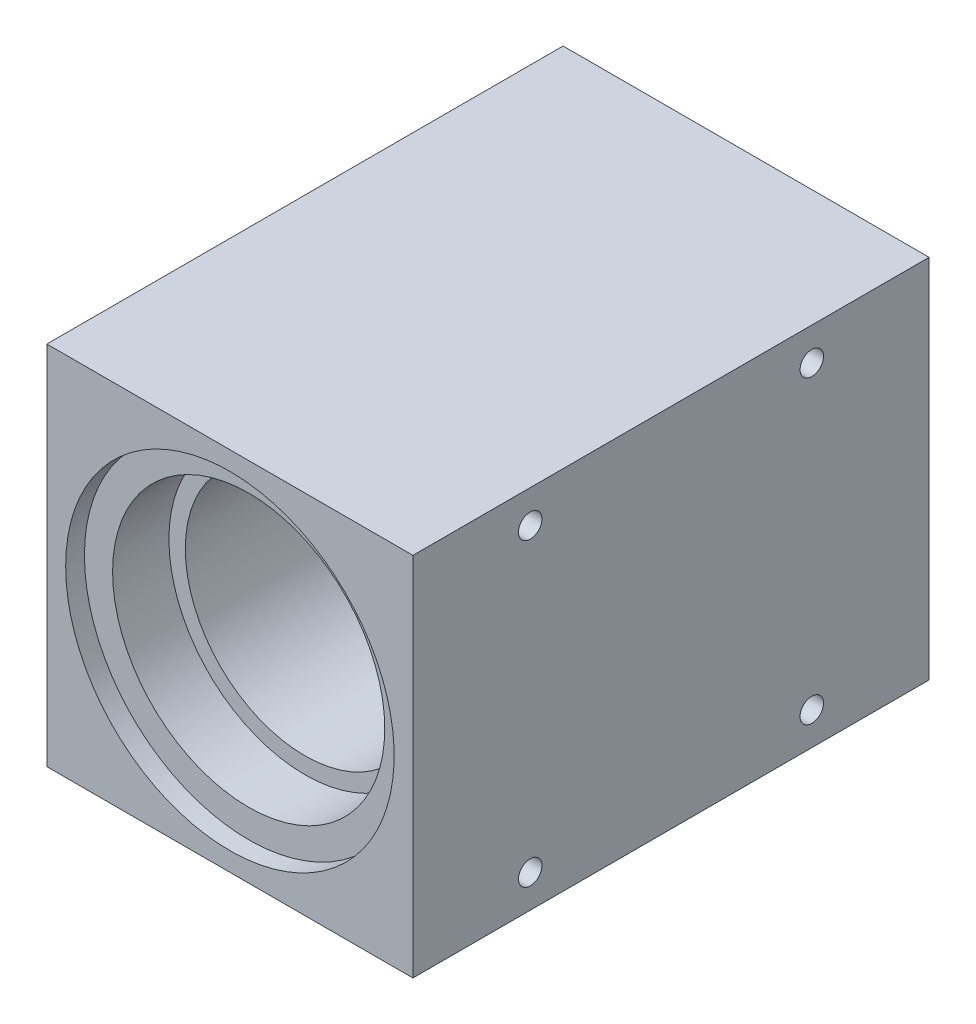
from build123d import *

# Parameters (mm, degrees)
SKETCH1_W           = 78
SKETCH1_H           = 78
SKETCH1_R           = 25.5
BOSS_EXTRUDE1_DEPTH = 110
CUT_EXTRUDE1_START  = -4
SKETCH2_R           = 29
CUT_EXTRUDE1_DEPTH  = 12
CUT_EXTRUDE2_START  = -16
SKETCH3_R           = 29
CUT_EXTRUDE2_DEPTH  = 12
THRUST_AX4565_R     = 35
THRUST_AX4565_R_2   = 25
CUT_EXTRUDE6_DEPTH  = 4
CUT_EXTRUDE7_START  = 4
SKETCH13_R          = 35
SKETCH13_R_2        = 25
CUT_EXTRUDE7_DEPTH  = 4
SKETCH8_R           = 2.5
CUT_EXTRUDE3_DEPTH  = 141.374499109


with BuildPart() as part:
    # Sketch1 → Boss-Extrude1 (new body)
    with BuildSketch(Plane.XY):
        Rectangle(SKETCH1_W, SKETCH1_H)
        Circle(SKETCH1_R, mode=Mode.SUBTRACT)
    extrude(amount=BOSS_EXTRUDE1_DEPTH)

    # Sketch2 → Cut-Extrude1 (cut)
    with BuildSketch(Plane(origin=(0, 0, 0), x_dir=(-1, 0, 0), z_dir=(0, 0, -1)).offset(CUT_EXTRUDE1_START)):
        Circle(SKETCH2_R)
    extrude(amount=-CUT_EXTRUDE1_DEPTH, mode=Mode.SUBTRACT)

    # Sketch3 → Cut-Extrude2 (cut)
    with BuildSketch(Plane.XY.offset(110).offset(CUT_EXTRUDE2_START)):
        with Locations(Location((0, 0, 0), (0, 0, 180))):
            Circle(SKETCH3_R)
    extrude(amount=CUT_EXTRUDE2_DEPTH, mode=Mode.SUBTRACT)

    # Thrust AX4565 → Cut-Extrude6 (cut)
    with BuildSketch(Plane.XY):
        Circle(THRUST_AX4565_R)
        Circle(THRUST_AX4565_R_2, mode=Mode.SUBTRACT)
    extrude(amount=CUT_EXTRUDE6_DEPTH, mode=Mode.SUBTRACT)

    # Sketch13 → Cut-Extrude7 (cut)
    with BuildSketch(Plane(origin=(0, 0, 110), x_dir=(-1, 0, 0), z_dir=(0, 0, -1)).offset(CUT_EXTRUDE7_START)):
        with Locations(Location((0, 0, 0), (0, 0, 180))):
            Circle(SKETCH13_R)
        Circle(SKETCH13_R_2, mode=Mode.SUBTRACT)
    extrude(amount=-CUT_EXTRUDE7_DEPTH, mode=Mode.SUBTRACT)

    # Sketch8 → Cut-Extrude3 (cut, through all)
    with BuildSketch(Plane(origin=(39, 0, 0), x_dir=(0, 0, -1), z_dir=(1, 0, 0))):
        with Locations(Location((-85, 32, 0), (0, 0, 90))):
            Circle(SKETCH8_R)
        with Locations(Location((-25, 32, 0), (0, 0, 90))):
            Circle(SKETCH8_R)
        with Locations(Location((-25, -32, 0), (0, 0, 90))):
            Circle(SKETCH8_R)
        with Locations(Location((-85, -32, 0), (0, 0, 90))):
            Circle(SKETCH8_R)
    extrude(amount=-CUT_EXTRUDE3_DEPTH, mode=Mode.SUBTRACT)


solid = part.part
